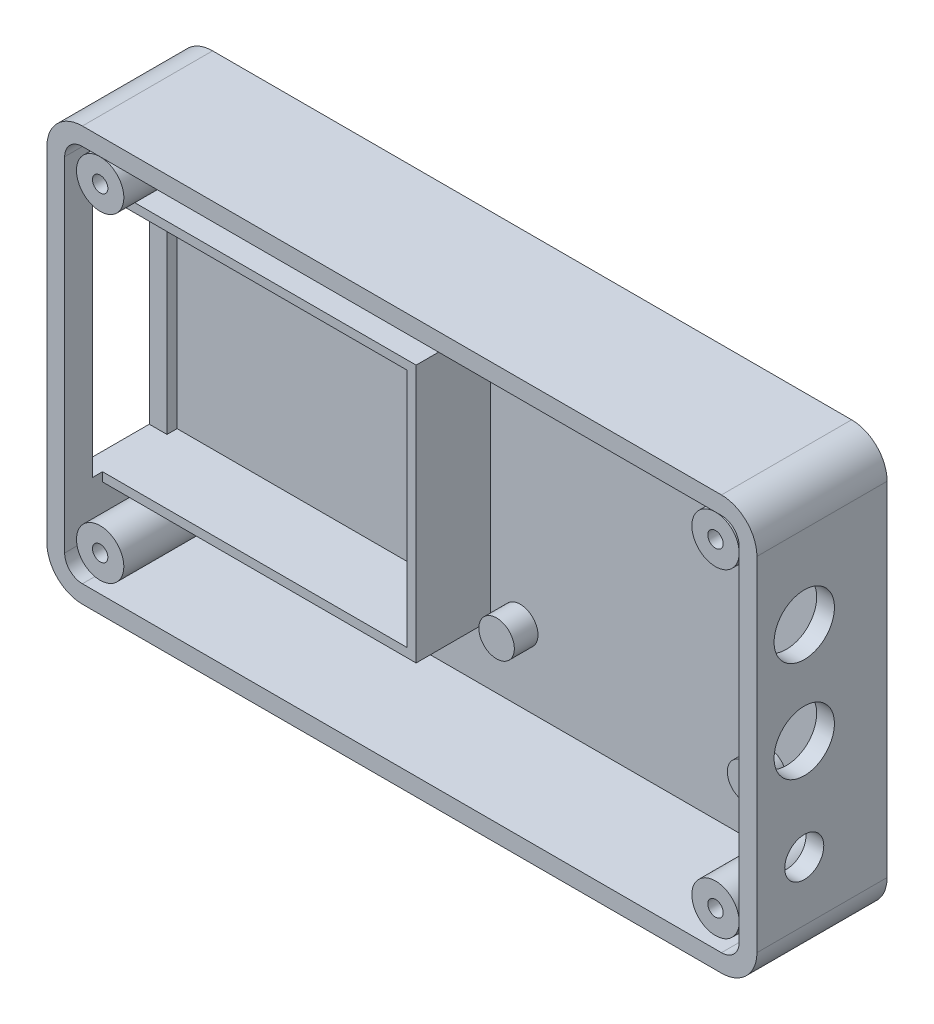
from build123d import *

# Parameters (mm, degrees)
SKETCH1_W           = 120
SKETCH1_H           = 70
BOSS_EXTRUDE1_DEPTH = 22
FILLET1_R           = 6
SHELL1_T            = -3
SKETCH2_R           = 4
BOSS_EXTRUDE2_DEPTH = 18.0000001
SKETCH4_R           = 1.3
CUT_EXTRUDE1_DEPTH  = 4
BOSS_EXTRUDE3_DEPTH = 12.6
CUT_EXTRUDE2_REACH  = 128.921
SKETCH6_W           = 12.6
SKETCH6_H           = 40.6
CUT_EXTRUDE3_REACH  = 128.921
SKETCH8_R           = 5.1
SKETCH8_R_2         = 3.3
SKETCH9_R           = 3
BOSS_EXTRUDE4_DEPTH = 4


with BuildPart() as part:
    # Sketch1 → Boss-Extrude1 (new body)
    with BuildSketch(Plane.XY):
        Rectangle(SKETCH1_W, SKETCH1_H)
    extrude(amount=BOSS_EXTRUDE1_DEPTH)

    # Fillet1
    fillet1_edges = [part.edges().sort_by_distance(p)[0] for p in [
        (-60, 35, 11),
        (60, 35, 11),
        (60, -35, 11),
        (-60, -35, 11),
    ]]
    fillet(fillet1_edges, radius=FILLET1_R)

    # Shell1
    shell1_openings = [part.faces().sort_by_distance(p)[0] for p in [
        (0, 0, 22),
    ]]
    offset(amount=SHELL1_T, openings=shell1_openings, kind=Kind.INTERSECTION)

    # Sketch2 → Boss-Extrude2 (add)
    with BuildSketch(Plane.XY.offset(3)):
        with Locations((-52, -27)):
            Circle(SKETCH2_R)
        with Locations(Location((52, -27, 0), (0, 0, 180))):
            Circle(SKETCH2_R)
        with Locations((52, 27)):
            Circle(SKETCH2_R)
        with Locations(Location((-52, 27, 0), (0, 0, 180))):
            Circle(SKETCH2_R)
    extrude(amount=BOSS_EXTRUDE2_DEPTH)

    # Sketch4 → Cut-Extrude1 (cut)
    with BuildSketch(Plane.XY.offset(21.0000001)):
        with Locations((-52, 27)):
            Circle(SKETCH4_R)
        with Locations(Location((-52, -27, 0), (0, 0, 180))):
            Circle(SKETCH4_R)
        with Locations((52, -27)):
            Circle(SKETCH4_R)
        with Locations(Location((52, 27, 0), (0, 0, 180))):
            Circle(SKETCH4_R)
    extrude(amount=-CUT_EXTRUDE1_DEPTH, mode=Mode.SUBTRACT)

    # Sketch5 → Boss-Extrude3 (add)
    with BuildSketch(Plane(origin=(0, 0, 3), x_dir=(-1, 0, 0), z_dir=(0, 0, -1))):
        Polygon((57, 21.8), (4, 21.8), (4, -21.8), (57, -21.8), (57, -20.3), (5.5, -20.3), (5.5, 20.3), (57, 20.3), align=None)
    extrude(amount=-BOSS_EXTRUDE3_DEPTH)

    # Sketch6 → Cut-Extrude2 (cut, up to next)
    with BuildSketch(Plane(origin=(-60, 0, 0), x_dir=(0, 0, -1), z_dir=(1, 0, 0)), mode=Mode.PRIVATE) as cut_extrude2_sk1:
        with Locations((-11, 0)):
            Rectangle(SKETCH6_W, SKETCH6_H)
    cut_extrude2_tool1 = extrude(cut_extrude2_sk1.sketch, amount=CUT_EXTRUDE2_REACH, mode=Mode.PRIVATE) & part.part
    add(cut_extrude2_tool1.solids().sort_by_distance((-60, 0, 11))[0], mode=Mode.SUBTRACT)

    # Sketch8 → Cut-Extrude3 (cut, up to next)
    with BuildSketch(Plane.ZY.offset(-60), mode=Mode.PRIVATE) as cut_extrude3_sk1:
        with Locations(Location((14, 15, 0), (0, 0, 270))):
            Circle(SKETCH8_R)
    cut_extrude3_tool1 = extrude(cut_extrude3_sk1.sketch, amount=CUT_EXTRUDE3_REACH, mode=Mode.PRIVATE) & part.part
    # Sketch8 → Cut-Extrude3 (cut, up to next)
    with BuildSketch(Plane.ZY.offset(-60), mode=Mode.PRIVATE) as cut_extrude3_sk2:
        with Locations(Location((14, -2, 0), (0, 0, 270))):
            Circle(SKETCH8_R)
    cut_extrude3_tool2 = extrude(cut_extrude3_sk2.sketch, amount=CUT_EXTRUDE3_REACH, mode=Mode.PRIVATE) & part.part
    # Sketch8 → Cut-Extrude3 (cut, up to next)
    with BuildSketch(Plane.ZY.offset(-60), mode=Mode.PRIVATE) as cut_extrude3_sk3:
        with Locations(Location((14, -19, 0), (0, 0, 270))):
            Circle(SKETCH8_R_2)
    cut_extrude3_tool3 = extrude(cut_extrude3_sk3.sketch, amount=CUT_EXTRUDE3_REACH, mode=Mode.PRIVATE) & part.part
    add(cut_extrude3_tool1.solids().sort_by_distance((60, 15, 14))[0], mode=Mode.SUBTRACT)
    add(cut_extrude3_tool2.solids().sort_by_distance((60, -2, 14))[0], mode=Mode.SUBTRACT)
    add(cut_extrude3_tool3.solids().sort_by_distance((60, -19, 14))[0], mode=Mode.SUBTRACT)

    # Sketch9 → Boss-Extrude4 (add)
    with BuildSketch(Plane.XY.offset(3)):
        with Locations((43, 20)):
            Circle(SKETCH9_R)
        with Locations((1, 20)):
            Circle(SKETCH9_R)
        with Locations(Location((1, -20, 0), (0, 0, 180))):
            Circle(SKETCH9_R)
        with Locations(Location((43, -20, 0), (0, 0, 180))):
            Circle(SKETCH9_R)
    extrude(amount=BOSS_EXTRUDE4_DEPTH)


solid = part.part
